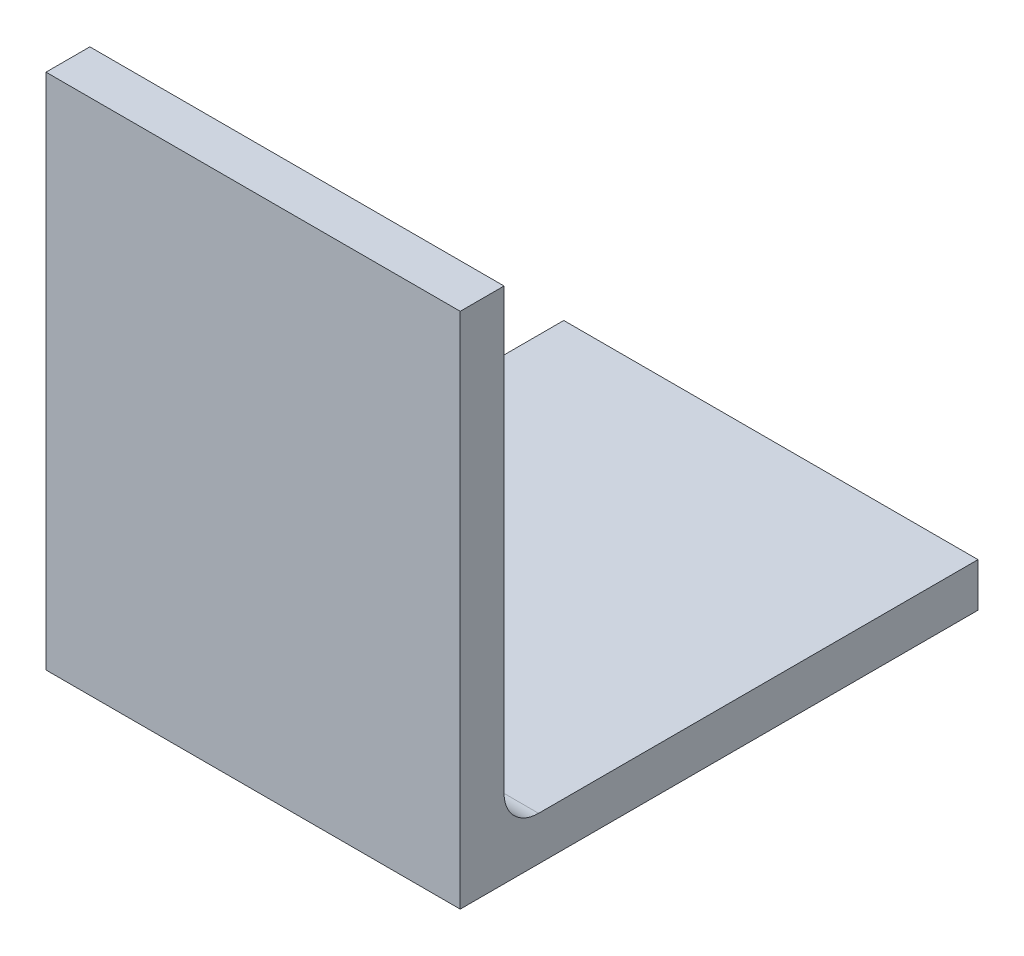
from build123d import *

# Parameters (mm, degrees)
SALIENTE_EXTRUIR1_DEPTH = 60


with BuildPart() as part:
    # Croquis1 → Saliente-Extruir1 (new, symmetric)
    with BuildSketch(Plane(origin=(0, 0, 0), x_dir=(0, 0, -1), z_dir=(1, 0, 0))):
        with BuildLine():
            Line((0, 0), (0, 150))
            Line((0, 150), (12.7, 150))
            Line((12.7, 150), (12.7, 22.7))
            ThreePointArc((12.7, 22.7), (15.628932188, 15.628932188), (22.7, 12.7))
            Line((22.7, 12.7), (150, 12.7))
            Line((150, 12.7), (150, 0))
            Line((150, 0), (0, 0))
        make_face()
    extrude(amount=SALIENTE_EXTRUIR1_DEPTH, both=True)


solid = part.part
